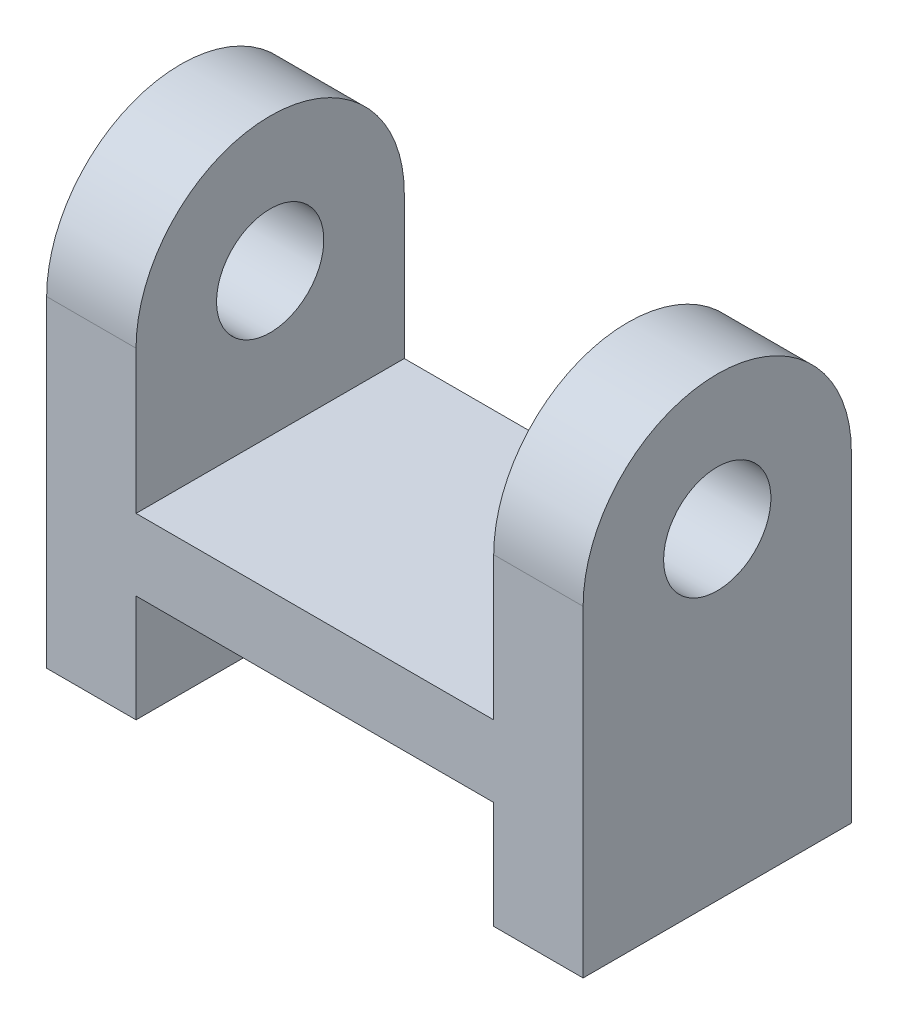
from build123d import *

# Parameters (mm, degrees)
EXTRUDE_1_DEPTH     = 15
EXTRUDE_2_DEPTH     = 5
SKETCH_4_R          = 3
CUT_EXTRUDE_1_DEPTH = 5


with BuildPart() as part:
    # 草图1 → 凸台-拉伸1 (new body)
    with BuildSketch(Plane.XY):
        Polygon((10, 6), (-10, 6), (-10, 0), (-15, 0), (-15, 10), (15, 10), (15, 0), (10, 0), align=None)
    extrude(amount=EXTRUDE_1_DEPTH)

    # 草图2 → 凸台-拉伸2 (add)
    with BuildSketch(Plane.ZY.offset(15)):
        with BuildLine():
            Line((0, 10), (0, 18))
            ThreePointArc((0, 18), (7.5, 25.5), (15, 18))
            Line((15, 18), (15, 10))
            Line((15, 10), (0, 10))
        make_face()
    extrude_2 = extrude(amount=-EXTRUDE_2_DEPTH)

    # 草图4 → 切除-拉伸1 (cut)
    with BuildSketch(Plane.ZY.offset(15)):
        with Locations((7.5, 18)):
            Circle(SKETCH_4_R)
    cut_extrude_1 = extrude(amount=-CUT_EXTRUDE_1_DEPTH, mode=Mode.SUBTRACT)

    # 镜向2: 凸台-拉伸2, 切除-拉伸1 across plane
    add(extrude_2.mirror(Plane(origin=(0, 0, 0), x_dir=(0, 0, 1), z_dir=(1, 0, 0))))
    add(cut_extrude_1.mirror(Plane(origin=(0, 0, 0), x_dir=(0, 0, 1), z_dir=(1, 0, 0))), mode=Mode.SUBTRACT)


solid = part.part
